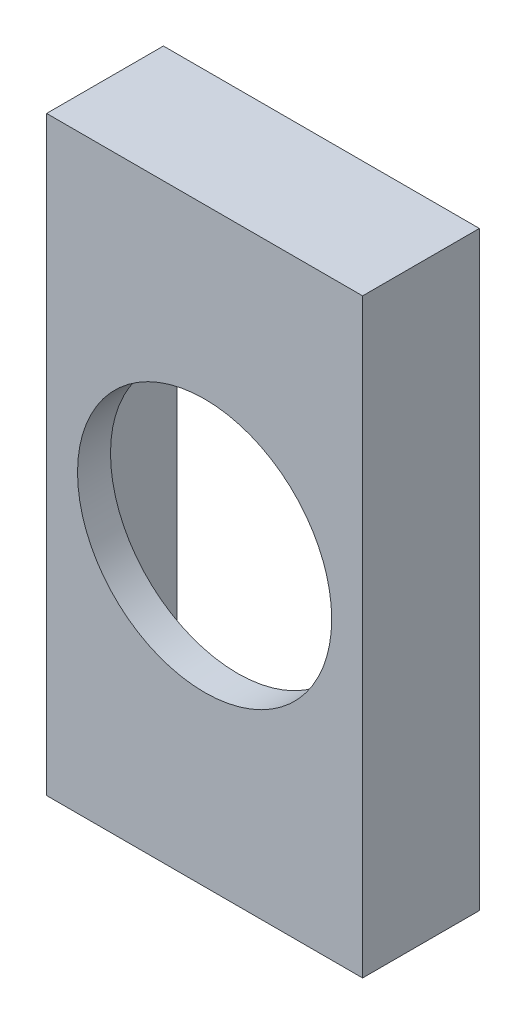
from build123d import *

# Parameters (mm, degrees)
ESBO_O1_W                = 23
ESBO_O1_H                = 43
RESSALTO_EXTRUS_O1_DEPTH = 8.5
ESBO_O2_W                = 21
ESBO_O2_H                = 33
CORTE_EXTRUS_O1_DEPTH    = 6.1
ESBO_O3_R                = 9.25
CORTE_EXTRUS_O2_DEPTH    = 26.821502667
ESBO_O4_R                = 1
CORTE_EXTRUS_O3_DEPTH    = 4


with BuildPart() as part:
    # Esboço1 → Ressalto-extrusão1 (new body)
    with BuildSketch(Plane.XY):
        Rectangle(ESBO_O1_W, ESBO_O1_H)
    extrude(amount=RESSALTO_EXTRUS_O1_DEPTH)

    # Esboço2 → Corte-extrusão1 (cut)
    with BuildSketch(Plane(origin=(0, 0, 0), x_dir=(-1, 0, 0), z_dir=(0, 0, -1))):
        Rectangle(ESBO_O2_W, ESBO_O2_H)
    extrude(amount=-CORTE_EXTRUS_O1_DEPTH, mode=Mode.SUBTRACT)

    # Esboço3 → Corte-extrusão2 (cut, through all)
    with BuildSketch(Plane.XY.offset(8.5)):
        Circle(ESBO_O3_R)
    extrude(amount=-CORTE_EXTRUS_O2_DEPTH, mode=Mode.SUBTRACT)

    # Esboço4 → Corte-extrusão3 (cut)
    with BuildSketch(Plane(origin=(0, 0, 0), x_dir=(-1, 0, 0), z_dir=(0, 0, -1))):
        with Locations((0, 19)):
            Circle(ESBO_O4_R)
        with Locations(Location((0, -19, 0), (0, 0, 180))):
            Circle(ESBO_O4_R)
    extrude(amount=-CORTE_EXTRUS_O3_DEPTH, mode=Mode.SUBTRACT)


solid = part.part
